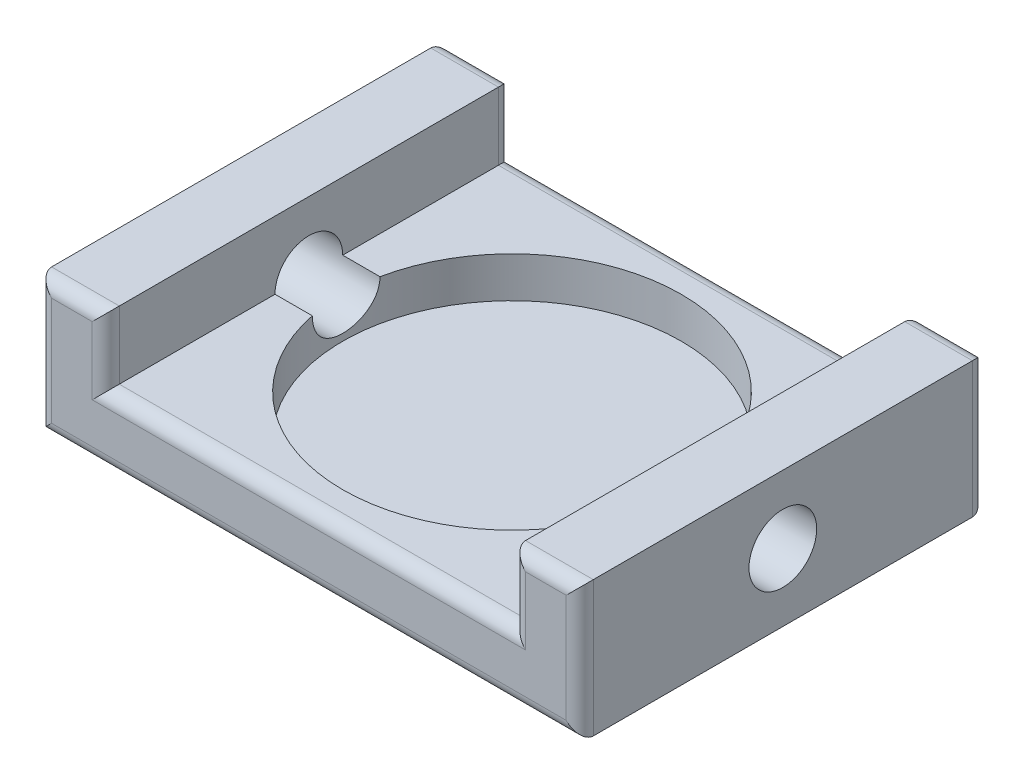
from build123d import *

# Parameters (mm, degrees)
SKETCH_1_W          = 40
SKETCH_1_H          = 30
EXTRUDE_1_DEPTH     = 10
SKETCH_3_R          = 2.5
CUT_EXTRUDE_1_DEPTH = 51.990195136
CUT_EXTRUDE_2_DEPTH = 5
SKETCH_5_R          = 12.5
CUT_EXTRUDE_3_DEPTH = 3
FILLET_1_R          = 1


with BuildPart() as part:
    # 草图1 → 凸台-拉伸1 (new body)
    with BuildSketch(Plane(origin=(0, 0, 0), x_dir=(1, 0, 0), z_dir=(0, 1, 0))):
        with Locations((20, 15)):
            Rectangle(SKETCH_1_W, SKETCH_1_H)
    extrude(amount=EXTRUDE_1_DEPTH)

    # 草图3 → 切除-拉伸1 (cut, through all)
    with BuildSketch(Plane.ZY):
        with Locations((-15, 5)):
            Circle(SKETCH_3_R)
    extrude(amount=-CUT_EXTRUDE_1_DEPTH, mode=Mode.SUBTRACT)

    # 草图4 → 切除-拉伸2 (cut)
    with BuildSketch(Plane(origin=(0, 10, 0), x_dir=(1, 0, 0), z_dir=(0, 1, 0))):
        Polygon((20, 30), (5, 30), (5, 0), (35, 0), (35, 30), align=None)
    extrude(amount=-CUT_EXTRUDE_2_DEPTH, mode=Mode.SUBTRACT)

    # 草图5 → 切除-拉伸3 (cut)
    with BuildSketch(Plane(origin=(0, 5, 0), x_dir=(1, 0, 0), z_dir=(0, 1, 0))):
        with Locations(Location((20, 15, 0), (0, 0, 270))):
            Circle(SKETCH_5_R)
    extrude(amount=-CUT_EXTRUDE_3_DEPTH, mode=Mode.SUBTRACT)

    # 圆角1
    fillet_1_edges = [part.edges().sort_by_distance(p)[0] for p in [
        (37.5, 10, -30),
        (37.5, 10, 0),
        (2.5, 10, -30),
        (35, 7.5, -30),
        (5, 7.5, 0),
        (20, 5, 0),
        (35, 7.5, 0),
        (20, 5, -30),
        (5, 7.5, -30),
        (20, 0, -30),
        (20, 0, 0),
        (2.5, 10, 0),
        (0, 5, -30),
        (40, 5, -30),
        (40, 5, 0),
        (0, 5, 0),
    ]]
    fillet(fillet_1_edges, radius=FILLET_1_R)


solid = part.part
